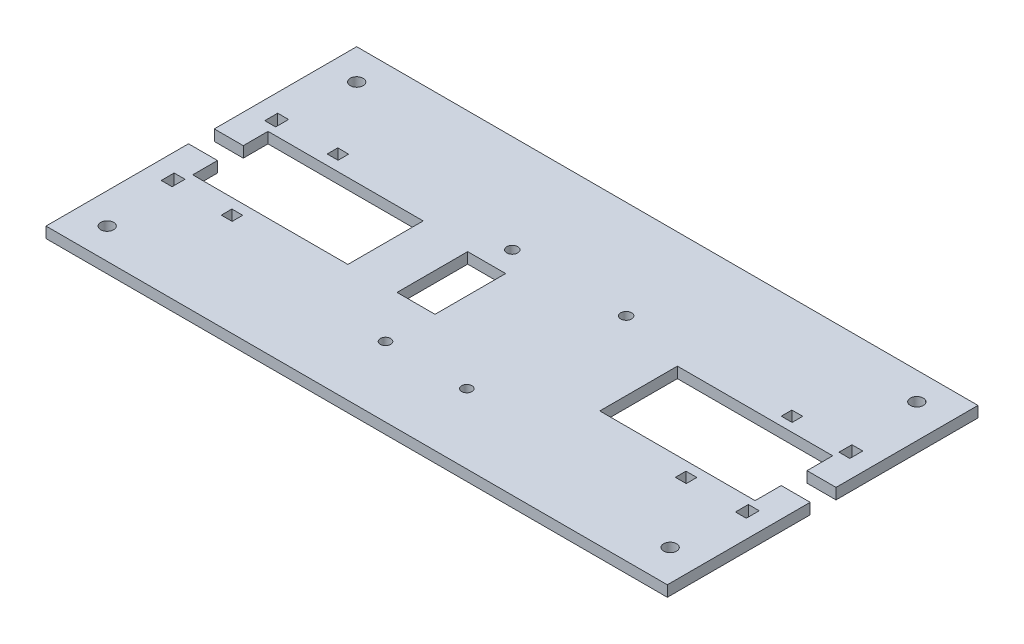
from build123d import *

# Parameters (mm, degrees)
SKETCH1_W           = 304.8
SKETCH1_H           = 152.4
BOSS_EXTRUDE1_DEPTH = 5.334
SKETCH2_R           = 3.175
CUT_EXTRUDE1_DEPTH  = 10
SKETCH4_R           = 2.676950891
SKETCH4_R_2         = 2.665674254
SKETCH4_R_3         = 2.530032229
SKETCH4_R_4         = 2.5353316
CUT_EXTRUDE3_DEPTH  = 252.586384458
SKETCH5_W           = 5.334
SKETCH5_H           = 6.35
SKETCH5_H_2         = 5.207
CUT_EXTRUDE4_DEPTH  = 252.586384458
SKETCH8_W           = 76.2
SKETCH8_H           = 34.29
CUT_EXTRUDE5_DEPTH  = 252.586384458
SKETCH10_W          = 76.2
SKETCH10_H          = 1.778250289
SKETCH10_H_2        = 2.019413315
CUT_EXTRUDE7_DEPTH  = 252.586384458
SKETCH11_W          = 76.121070341
SKETCH11_H          = 36.949838164
CUT_EXTRUDE8_DEPTH  = 252.586384458
SKETCH12_W          = 14.224
SKETCH12_H          = 12.638991695
CUT_EXTRUDE9_DEPTH  = 252.586384458
SKETCH13_W          = 18.627313318
SKETCH13_H          = 34.653875248
CUT_EXTRUDE10_DEPTH = 252.586384458
CUT_EXTRUDE11_DEPTH = 252.586384458


with BuildPart() as part:
    # Sketch1 → Boss-Extrude1 (new body)
    with BuildSketch(Plane(origin=(0, 0, 0), x_dir=(1, 0, 0), z_dir=(0, 1, 0))):
        with Locations((-63.754910023, -52.424694992)):
            Rectangle(SKETCH1_W, SKETCH1_H)
    extrude(amount=BOSS_EXTRUDE1_DEPTH)

    # Sketch2 → Cut-Extrude1 (cut)
    with BuildSketch(Plane(origin=(0, 5.334, 0), x_dir=(1, 0, 0), z_dir=(0, 1, 0))):
        with Locations(Location((-201.154910023, -113.624694992, 0), (0, 0, 270))):
            Circle(SKETCH2_R)
        with Locations(Location((-201.154910023, 8.775305008, 0), (0, 0, 270))):
            Circle(SKETCH2_R)
        with Locations(Location((73.468003191, -112.082866523, 0), (0, 0, 270))):
            Circle(SKETCH2_R)
        with Locations(Location((72.093654241, 10.309417404, 0), (0, 0, 270))):
            Circle(SKETCH2_R)
    extrude(amount=-CUT_EXTRUDE1_DEPTH, mode=Mode.SUBTRACT)

    # Sketch4 → Cut-Extrude3 (cut, through all)
    with BuildSketch(Plane(origin=(0, 5.334, 0), x_dir=(1, 0, 0), z_dir=(0, 1, 0))):
        with Locations(Location((-91.687860004, -24.357805151, 0), (0, 0, 270))):
            Circle(SKETCH4_R)
        with Locations(Location((-35.688020182, -24.491745011, 0), (0, 0, 270))):
            Circle(SKETCH4_R_2)
        with Locations(Location((-43.855422124, -94.472410523, 0), (0, 0, 270))):
            Circle(SKETCH4_R_3)
        with Locations(Location((-83.855307711, -94.376739195, 0), (0, 0, 270))):
            Circle(SKETCH4_R_4)
    extrude(amount=-CUT_EXTRUDE3_DEPTH, mode=Mode.SUBTRACT)

    # Sketch5 → Cut-Extrude4 (cut, through all)
    with BuildSketch(Plane(origin=(0, 5.334, 0), x_dir=(1, 0, 0), z_dir=(0, 1, 0))):
        with Locations((-204.597910023, -77.824694992)):
            Rectangle(SKETCH5_W, SKETCH5_H)
        with Locations((-204.597910023, -27.024694992)):
            Rectangle(SKETCH5_W, SKETCH5_H)
        with Locations((-175.133910023, -26.453194992)):
            Rectangle(SKETCH5_W, SKETCH5_H_2)
        with Locations((-175.133910023, -78.396194992)):
            Rectangle(SKETCH5_W, SKETCH5_H_2)
        with Locations((77.088089977, -77.824694992)):
            Rectangle(SKETCH5_W, SKETCH5_H)
        with Locations((47.624089977, -78.396194992)):
            Rectangle(SKETCH5_W, SKETCH5_H_2)
        with Locations((77.088089977, -27.024694992)):
            Rectangle(SKETCH5_W, SKETCH5_H)
        with Locations((47.624089977, -26.453194992)):
            Rectangle(SKETCH5_W, SKETCH5_H_2)
    extrude(amount=-CUT_EXTRUDE4_DEPTH, mode=Mode.SUBTRACT)

    # Sketch8 → Cut-Extrude5 (cut, through all)
    with BuildSketch(Plane(origin=(0, 5.334, 0), x_dir=(1, 0, 0), z_dir=(0, 1, 0))):
        with Locations((36.321089977, -52.424694992)):
            Rectangle(SKETCH8_W, SKETCH8_H)
    extrude(amount=-CUT_EXTRUDE5_DEPTH, mode=Mode.SUBTRACT)

    # Sketch10 → Cut-Extrude7 (cut, through all)
    with BuildSketch(Plane(origin=(0, 5.334, 0), x_dir=(1, 0, 0), z_dir=(0, 1, 0))):
        with Locations((36.321089977, -70.458820137)):
            Rectangle(SKETCH10_W, SKETCH10_H)
        with Locations((36.321089977, -34.269988334)):
            Rectangle(SKETCH10_W, SKETCH10_H_2)
    extrude(amount=-CUT_EXTRUDE7_DEPTH, mode=Mode.SUBTRACT)

    # Sketch11 → Cut-Extrude8 (cut, through all)
    with BuildSketch(Plane(origin=(0, 5.334, 0), x_dir=(1, 0, 0), z_dir=(0, 1, 0))):
        with Locations((-163.870374853, -52.409398233)):
            Rectangle(SKETCH11_W, SKETCH11_H)
    extrude(amount=-CUT_EXTRUDE8_DEPTH, mode=Mode.SUBTRACT)

    # Sketch12 → Cut-Extrude9 (cut, through all)
    with BuildSketch(Plane(origin=(0, 5.334, 0), x_dir=(1, 0, 0), z_dir=(0, 1, 0))):
        with Locations((-209.042910023, -52.397947161)):
            Rectangle(SKETCH12_W, SKETCH12_H)
    extrude(amount=-CUT_EXTRUDE9_DEPTH, mode=Mode.SUBTRACT)

    # Sketch13 → Cut-Extrude10 (cut, through all)
    with BuildSketch(Plane(origin=(0, 5.334, 0), x_dir=(1, 0, 0), z_dir=(0, 1, 0))):
        with Locations((-92.547768292, -53.386052829)):
            Rectangle(SKETCH13_W, SKETCH13_H)
    extrude(amount=-CUT_EXTRUDE10_DEPTH, mode=Mode.SUBTRACT)

    # Sketch14 → Cut-Extrude11 (cut, through all)
    with BuildSketch(Plane(origin=(0, 5.334, 0), x_dir=(1, 0, 0), z_dir=(0, 1, 0))):
        Polygon((74.421089977, -52.304113479), (74.421089977, -58.539435279), (88.645089977, -58.539435279), (88.645089977, -45.874866735), (74.421089977, -45.874866735), align=None)
    extrude(amount=-CUT_EXTRUDE11_DEPTH, mode=Mode.SUBTRACT)


solid = part.part
